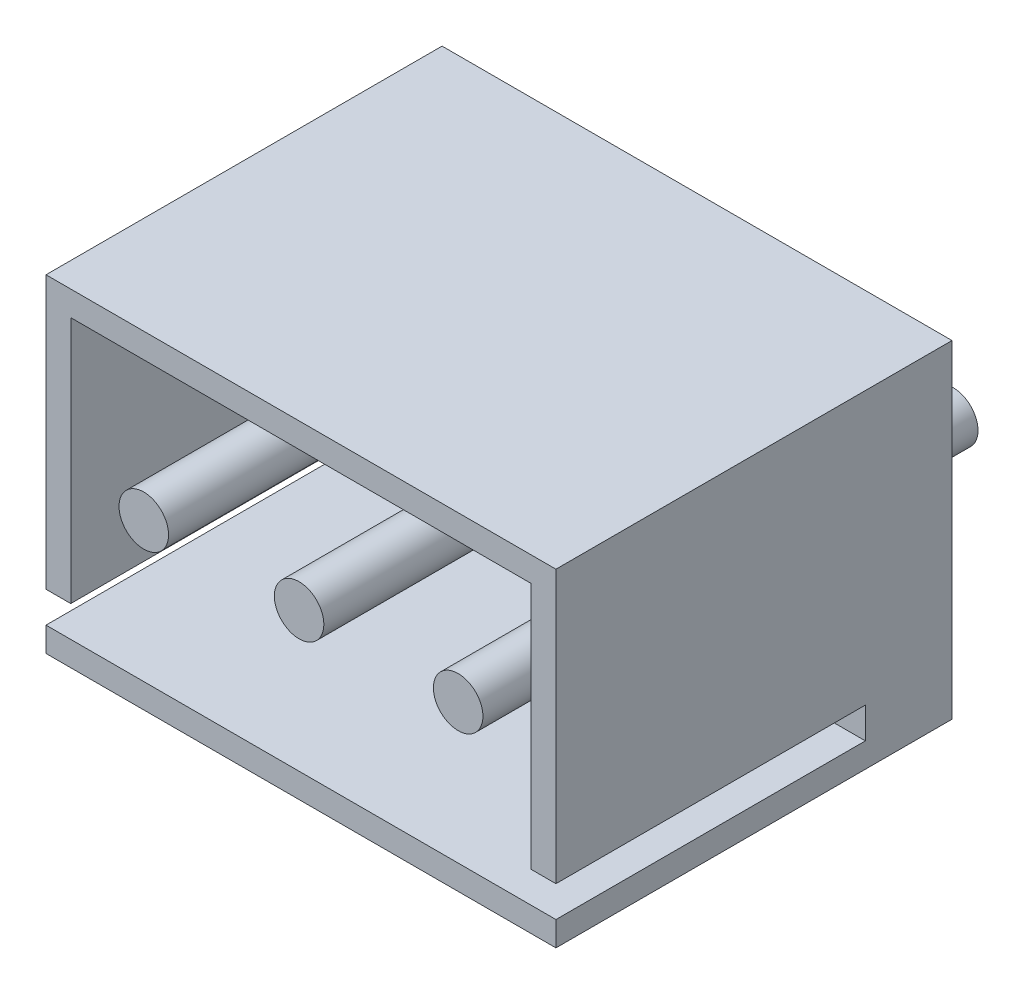
from build123d import *

# Parameters (mm, degrees)
SKETCH_1_W          = 8.24
SKETCH_1_H          = 5.3
EXTRUDE_1_DEPTH     = 6.4
SKETCH_2_W          = 7.44
SKETCH_2_H          = 4.5
SKETCH_2_R          = 0.4
CUT_EXTRUDE_1_DEPTH = 5
SKETCH_3_W          = 9.698331409
SKETCH_3_H          = 0.501475964
CUT_EXTRUDE_2_DEPTH = 5
SKETCH_4_R          = 0.4
EXTRUDE_2_DEPTH     = 8


with BuildPart() as part:
    # Эскиз1 → Вытянуть1 (new body)
    with BuildSketch(Plane.XY):
        Rectangle(SKETCH_1_W, SKETCH_1_H)
    extrude(amount=EXTRUDE_1_DEPTH)

    # Эскиз2 → Вырез-Вытянуть1 (cut)
    with BuildSketch(Plane.XY.offset(6.4)):
        Rectangle(SKETCH_2_W, SKETCH_2_H)
        with Locations((-2.54, 0)):
            Circle(SKETCH_2_R, mode=Mode.SUBTRACT)
        with Locations((2.54, 0)):
            Circle(SKETCH_2_R, mode=Mode.SUBTRACT)
        with Locations((-0.030392483, 0)):
            Circle(SKETCH_2_R, mode=Mode.SUBTRACT)
    extrude(amount=-CUT_EXTRUDE_1_DEPTH, mode=Mode.SUBTRACT)

    # Эскиз3 → Вырез-Вытянуть2 (cut)
    with BuildSketch(Plane.XY.offset(6.4)):
        with Locations((-0.050465246, -2.002104797)):
            Rectangle(SKETCH_3_W, SKETCH_3_H)
    extrude(amount=-CUT_EXTRUDE_2_DEPTH, mode=Mode.SUBTRACT)

    # Эскиз4 → Вытянуть2 (add)
    with BuildSketch(Plane.XY.offset(6.4)):
        with Locations((-2.54, 0)):
            Circle(SKETCH_4_R)
        with Locations((2.54, 0)):
            Circle(SKETCH_4_R)
        with Locations((-0.030392483, 0)):
            Circle(SKETCH_4_R)
    extrude(amount=-EXTRUDE_2_DEPTH)


solid = part.part
